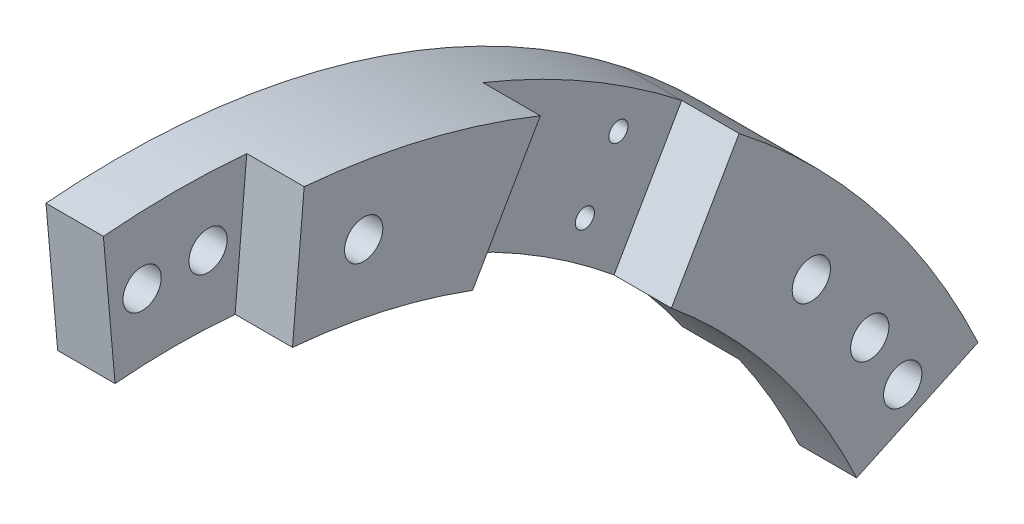
from build123d import *

# Parameters (mm, degrees)
SKETCH1_R             = 6.35
BOSS_EXTRUDE9_DEPTH   = 38.1
BOSS_EXTRUDE9_2_DEPTH = 38.1
SKETCH1_8_R           = 6.35
SKETCH1_8_R_2         = 3.175
BOSS_EXTRUDE10_DEPTH  = 19.05
BOSS_EXTRUDE12_START  = 19.05
SKETCH1_10_R          = 6.35
BOSS_EXTRUDE12_DEPTH  = 19.05


with BuildPart() as part:
    # Sketch1 → Boss-Extrude9 (new body)
    with BuildSketch(Plane(origin=(0, 0, 0), x_dir=(0, 0, -1), z_dir=(1, 0, 0))):
        with BuildLine():
            ThreePointArc((19.923802792, 227.730107984), (50.268386101, 223.004594928), (79.705751984, 214.254412092))
            Line((79.705751984, 214.254412092), (102.193829352, 253.204904657))
            ThreePointArc((102.193829352, 253.204904657), (63.69375462, 265.517246375), (23.797875557, 272.010962314))
            Line((23.797875557, 272.010962314), (19.923802792, 227.730107984))
        make_face()
        with Locations(Location((43.555304163, 247.014404649, 0), (0, 0, 180))):
            Circle(SKETCH1_R, mode=Mode.SUBTRACT)
    extrude(amount=BOSS_EXTRUDE9_DEPTH)

    # Sketch1<8> → Boss-Extrude10 (add)
    # profile 1 of 2: a face of its own
    with BuildSketch(Plane(origin=(0, 0, 0), x_dir=(0, 0, -1), z_dir=(1, 0, 0))):
        with BuildLine():
            ThreePointArc((-19.923802792, 227.730107984), (0, 228.6), (19.923802792, 227.730107984))
            Line((19.923802792, 227.730107984), (23.797875557, 272.010962314))
            ThreePointArc((23.797875557, 272.010962314), (0, 273.05), (-23.797875557, 272.010962314))
            Line((-23.797875557, 272.010962314), (-19.923802792, 227.730107984))
        make_face()
        with Locations(Location((10.940832836, 250.586270178, 0), (0, 0, 180))):
            Circle(SKETCH1_8_R, mode=Mode.SUBTRACT)
        with Locations(Location((-10.940832836, 250.586270178, 0), (0, 0, 180))):
            Circle(SKETCH1_8_R, mode=Mode.SUBTRACT)
    # profile 2 of 2: a face of its own
    with BuildSketch(Plane(origin=(0, 0, 0), x_dir=(0, 0, -1), z_dir=(1, 0, 0))):
        with BuildLine():
            Line((102.193829352, 253.204904657), (79.705751984, 214.254412092))
            ThreePointArc((79.705751984, 214.254412092), (114.3, 197.973407305), (145.696887752, 176.154412092))
            Line((145.696887752, 176.154412092), (168.18496512, 215.104904657))
            ThreePointArc((168.18496512, 215.104904657), (136.525, 236.468236503), (102.193829352, 253.204904657))
        make_face()
        with Locations(Location((102.924280642, 216.491743747, 0), (0, 0, 180))):
            Circle(SKETCH1_8_R_2, mode=Mode.SUBTRACT)
        with Locations(Location((114.078247165, 235.791024914, 0), (0, 0, 180))):
            Circle(SKETCH1_8_R_2, mode=Mode.SUBTRACT)
        with Locations(Location((147.161893977, 216.690172521, 0), (0, 0, 180))):
            Circle(SKETCH1_8_R_2, mode=Mode.SUBTRACT)
        with Locations(Location((136.025209473, 197.380913576, 0), (0, 0, 180))):
            Circle(SKETCH1_8_R_2, mode=Mode.SUBTRACT)
    extrude(amount=BOSS_EXTRUDE10_DEPTH)


with BuildPart() as body_2:
    # Sketch1 → Boss-Extrude9 2 (new body)
    with BuildSketch(Plane(origin=(0, 0, 0), x_dir=(0, 0, -1), z_dir=(1, 0, 0))):
        with BuildLine():
            ThreePointArc((145.696887752, 176.154412092), (167.993451318, 155.035996834), (187.258157324, 131.11957335))
            Line((187.258157324, 131.11957335), (223.669465693, 156.615045946))
            ThreePointArc((223.669465693, 156.615045946), (198.097803193, 187.919032751), (168.18496512, 215.104904657))
            Line((168.18496512, 215.104904657), (145.696887752, 176.154412092))
        make_face()
        with Locations(Location((192.143097445, 161.2272022, 0), (0, 0, 180))):
            Circle(SKETCH1_R, mode=Mode.SUBTRACT)
    extrude(amount=BOSS_EXTRUDE9_2_DEPTH)

    # Sketch1<10> → Boss-Extrude12 (add)
    # profile 1 of 3: a face of its own
    with BuildSketch(Plane(origin=(0, 0, 0), x_dir=(0, 0, -1), z_dir=(1, 0, 0)).offset(BOSS_EXTRUDE12_START)):
        with BuildLine():
            ThreePointArc((214.887446965, 129.369879654), (216.063194968, 127.396532155), (217.220821904, 125.4125))
            Line((217.220821904, 125.4125), (236.468236503, 136.525))
            ThreePointArc((236.468236503, 136.525), (230.288034279, 146.709658059), (223.669465693, 156.615045946))
            Line((223.669465693, 156.615045946), (205.463811509, 143.867309648))
            ThreePointArc((205.463811509, 143.867309648), (206.772721017, 141.97965512), (208.064288645, 140.08009286))
            ThreePointArc((208.064288645, 140.08009286), (214.562640659, 140.354608917), (217.893659396, 134.768174264))
            ThreePointArc((217.893659396, 134.768174264), (217.091431519, 131.678720515), (214.887446965, 129.369879654))
        make_face()
    # profile 2 of 3: a face of its own
    with BuildSketch(Plane(origin=(0, 0, 0), x_dir=(0, 0, -1), z_dir=(1, 0, 0)).offset(BOSS_EXTRUDE12_START)):
        with BuildLine():
            ThreePointArc((187.258157324, 131.11957335), (192.799284513, 122.826690468), (197.973407305, 114.3))
            Line((197.973407305, 114.3), (217.220821904, 125.4125))
            ThreePointArc((217.220821904, 125.4125), (216.063194968, 127.396532155), (214.887446965, 129.369879654))
            ThreePointArc((214.887446965, 129.369879654), (206.188123715, 131.356321751), (208.064288645, 140.08009286))
            ThreePointArc((208.064288645, 140.08009286), (206.772721017, 141.97965512), (205.463811509, 143.867309648))
            Line((205.463811509, 143.867309648), (187.258157324, 131.11957335))
        make_face()
    # profile 3 of 3: a face of its own
    with BuildSketch(Plane(origin=(0, 0, 0), x_dir=(0, 0, -1), z_dir=(1, 0, 0)).offset(BOSS_EXTRUDE12_START)):
        with BuildLine():
            ThreePointArc((197.973407305, 114.3), (202.770676465, 105.555732986), (207.181960117, 96.610534634))
            Line((207.181960117, 96.610534634), (247.46734125, 115.395916368))
            ThreePointArc((247.46734125, 115.395916368), (242.198307999, 126.080458844), (236.468236503, 136.525))
            Line((236.468236503, 136.525), (217.220821904, 125.4125))
            Line((217.220821904, 125.4125), (197.973407305, 114.3))
        make_face()
        with Locations(Location((222.484492232, 115.818095915, 0), (0, 0, 180))):
            Circle(SKETCH1_10_R, mode=Mode.SUBTRACT)
    extrude(amount=BOSS_EXTRUDE12_DEPTH)


solid = Compound([part.part, body_2.part])
